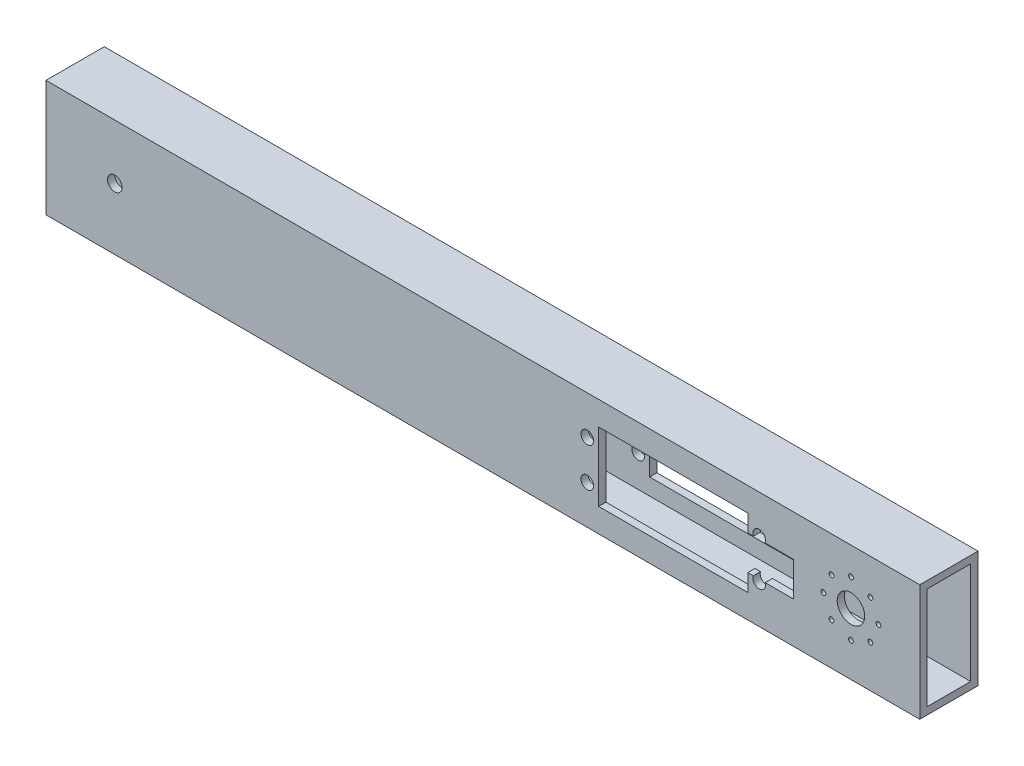
from build123d import *

# Parameters (mm, degrees)
SKETCH1_W           = 381
SKETCH1_H           = 25.4
BOSS_EXTRUDE1_DEPTH = 50.8
SKETCH2_W           = 19.05
SKETCH2_H           = 44.45
CUT_EXTRUDE1_DEPTH  = 386.210072558
SKETCH3_R           = 3.175
CUT_EXTRUDE2_DEPTH  = 386.210072558
CUT_EXTRUDE3_START  = -25.4
CUT_EXTRUDE3_DEPTH  = 25.4
SKETCH7_R           = 2.75
CUT_EXTRUDE4_DEPTH  = 386.210072558
CUT_EXTRUDE5_REACH  = 387.21
SKETCH8_R           = 6
SKETCH8_R_2         = 1.05


with BuildPart() as part:
    # Sketch1 → Boss-Extrude1 (new body)
    with BuildSketch(Plane(origin=(0, 0, 0), x_dir=(1, 0, 0), z_dir=(0, 1, 0))):
        with Locations((-190.5, 12.7)):
            Rectangle(SKETCH1_W, SKETCH1_H)
    extrude(amount=BOSS_EXTRUDE1_DEPTH)

    # Sketch2 → Cut-Extrude1 (cut, through all)
    with BuildSketch(Plane.ZY.offset(381)):
        with Locations((-12.7, 25.4)):
            Rectangle(SKETCH2_W, SKETCH2_H)
    extrude(amount=-CUT_EXTRUDE1_DEPTH, mode=Mode.SUBTRACT)

    # Sketch3 → Cut-Extrude2 (cut, through all)
    with BuildSketch(Plane(origin=(0, 0, -25.4), x_dir=(-1, 0, 0), z_dir=(0, 0, -1))):
        with Locations((351, 26.848062316)):
            Circle(SKETCH3_R)
        with Locations(Location((30, 26.848062316, 0), (0, 0, 270))):
            Circle(SKETCH3_R)
    extrude(amount=-CUT_EXTRUDE2_DEPTH, mode=Mode.SUBTRACT)

    # Sketch5 → Cut-Extrude3 (cut)
    with BuildSketch(Plane.XY.offset(CUT_EXTRUDE3_START)):
        Polygon((-75, 32.9), (-75, 40.4), (-140, 40.4), (-140, 10.4), (-75, 10.4), (-75, 17.9), (-55, 17.9), (-55, 32.9), align=None)
    extrude(amount=CUT_EXTRUDE3_DEPTH, mode=Mode.SUBTRACT)

    # Sketch7 → Cut-Extrude4 (cut, through all)
    with BuildSketch(Plane.XY):
        with Locations((-145, 33.982591354)):
            Circle(SKETCH7_R)
        with Locations((-70, 33.982591354)):
            Circle(SKETCH7_R)
        with Locations((-145, 16.982591354)):
            Circle(SKETCH7_R)
        with Locations((-70, 16.982591354)):
            Circle(SKETCH7_R)
    extrude(amount=-CUT_EXTRUDE4_DEPTH, mode=Mode.SUBTRACT)

    # Sketch8 → Cut-Extrude5 (cut, up to next)
    with BuildSketch(Plane.XY, mode=Mode.PRIVATE) as cut_extrude5_sk1:
        with Locations((-30, 26.848062316)):
            Circle(SKETCH8_R)
    cut_extrude5_tool1 = extrude(cut_extrude5_sk1.sketch, amount=-CUT_EXTRUDE5_REACH, mode=Mode.PRIVATE) & part.part
    # Sketch8 → Cut-Extrude5 (cut, up to next)
    with BuildSketch(Plane.XY, mode=Mode.PRIVATE) as cut_extrude5_sk2:
        with Locations((-30, 38.848062316)):
            Circle(SKETCH8_R_2)
    cut_extrude5_tool2 = extrude(cut_extrude5_sk2.sketch, amount=-CUT_EXTRUDE5_REACH, mode=Mode.PRIVATE) & part.part
    # Sketch8 → Cut-Extrude5 (cut, up to next)
    with BuildSketch(Plane.XY, mode=Mode.PRIVATE) as cut_extrude5_sk3:
        with Locations((-21.514718626, 35.33334369)):
            Circle(SKETCH8_R_2)
    cut_extrude5_tool3 = extrude(cut_extrude5_sk3.sketch, amount=-CUT_EXTRUDE5_REACH, mode=Mode.PRIVATE) & part.part
    # Sketch8 → Cut-Extrude5 (cut, up to next)
    with BuildSketch(Plane.XY, mode=Mode.PRIVATE) as cut_extrude5_sk4:
        with Locations((-18, 26.848062316)):
            Circle(SKETCH8_R_2)
    cut_extrude5_tool4 = extrude(cut_extrude5_sk4.sketch, amount=-CUT_EXTRUDE5_REACH, mode=Mode.PRIVATE) & part.part
    # Sketch8 → Cut-Extrude5 (cut, up to next)
    with BuildSketch(Plane.XY, mode=Mode.PRIVATE) as cut_extrude5_sk5:
        with Locations((-21.514718626, 18.362780942)):
            Circle(SKETCH8_R_2)
    cut_extrude5_tool5 = extrude(cut_extrude5_sk5.sketch, amount=-CUT_EXTRUDE5_REACH, mode=Mode.PRIVATE) & part.part
    # Sketch8 → Cut-Extrude5 (cut, up to next)
    with BuildSketch(Plane.XY, mode=Mode.PRIVATE) as cut_extrude5_sk6:
        with Locations((-30, 14.848062316)):
            Circle(SKETCH8_R_2)
    cut_extrude5_tool6 = extrude(cut_extrude5_sk6.sketch, amount=-CUT_EXTRUDE5_REACH, mode=Mode.PRIVATE) & part.part
    # Sketch8 → Cut-Extrude5 (cut, up to next)
    with BuildSketch(Plane.XY, mode=Mode.PRIVATE) as cut_extrude5_sk7:
        with Locations((-38.485281374, 18.362780942)):
            Circle(SKETCH8_R_2)
    cut_extrude5_tool7 = extrude(cut_extrude5_sk7.sketch, amount=-CUT_EXTRUDE5_REACH, mode=Mode.PRIVATE) & part.part
    # Sketch8 → Cut-Extrude5 (cut, up to next)
    with BuildSketch(Plane.XY, mode=Mode.PRIVATE) as cut_extrude5_sk8:
        with Locations((-42, 26.848062316)):
            Circle(SKETCH8_R_2)
    cut_extrude5_tool8 = extrude(cut_extrude5_sk8.sketch, amount=-CUT_EXTRUDE5_REACH, mode=Mode.PRIVATE) & part.part
    # Sketch8 → Cut-Extrude5 (cut, up to next)
    with BuildSketch(Plane.XY, mode=Mode.PRIVATE) as cut_extrude5_sk9:
        with Locations((-38.485281374, 35.33334369)):
            Circle(SKETCH8_R_2)
    cut_extrude5_tool9 = extrude(cut_extrude5_sk9.sketch, amount=-CUT_EXTRUDE5_REACH, mode=Mode.PRIVATE) & part.part
    add(cut_extrude5_tool1.solids().sort_by_distance((-30, 26.848062, 0))[0], mode=Mode.SUBTRACT)
    add(cut_extrude5_tool2.solids().sort_by_distance((-30, 38.848062, 0))[0], mode=Mode.SUBTRACT)
    add(cut_extrude5_tool3.solids().sort_by_distance((-21.514719, 35.333344, 0))[0], mode=Mode.SUBTRACT)
    add(cut_extrude5_tool4.solids().sort_by_distance((-18, 26.848062, 0))[0], mode=Mode.SUBTRACT)
    add(cut_extrude5_tool5.solids().sort_by_distance((-21.514719, 18.362781, 0))[0], mode=Mode.SUBTRACT)
    add(cut_extrude5_tool6.solids().sort_by_distance((-30, 14.848062, 0))[0], mode=Mode.SUBTRACT)
    add(cut_extrude5_tool7.solids().sort_by_distance((-38.485281, 18.362781, 0))[0], mode=Mode.SUBTRACT)
    add(cut_extrude5_tool8.solids().sort_by_distance((-42, 26.848062, 0))[0], mode=Mode.SUBTRACT)
    add(cut_extrude5_tool9.solids().sort_by_distance((-38.485281, 35.333344, 0))[0], mode=Mode.SUBTRACT)


solid = part.part
